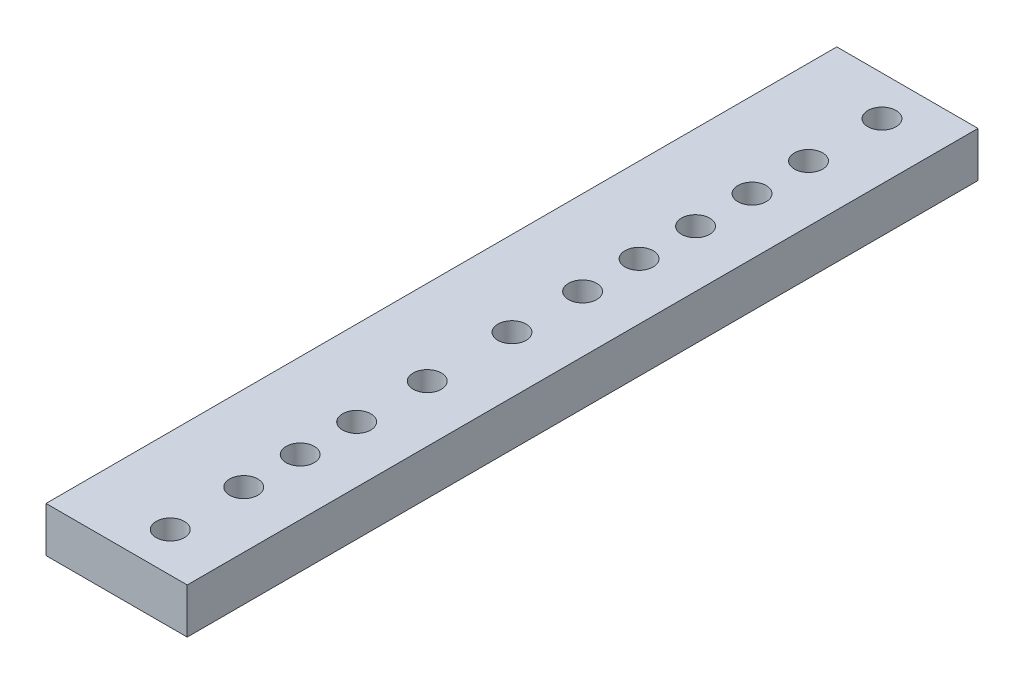
from build123d import *

# Parameters (mm, degrees)
SKETCH1_W           = 25
SKETCH1_H           = 140
BOSS_EXTRUDE1_DEPTH = 8
SKETCH2_R           = 2.5
CUT_EXTRUDE1_DEPTH  = 143.439460825
SKETCH3_R           = 2.5
CUT_EXTRUDE2_DEPTH  = 143.439460825


with BuildPart() as part:
    # Sketch1 → Boss-Extrude1 (new body)
    with BuildSketch(Plane(origin=(0, 0, 0), x_dir=(1, 0, 0), z_dir=(0, 1, 0))):
        with Locations((12.5, 70)):
            Rectangle(SKETCH1_W, SKETCH1_H)
    extrude(amount=BOSS_EXTRUDE1_DEPTH)

    # Sketch2 → Cut-Extrude1 (cut, through all)
    with BuildSketch(Plane(origin=(0, 8, 0), x_dir=(1, 0, 0), z_dir=(0, 1, 0))):
        with Locations(Location((15, 7, 0), (0, 0, 270))):
            Circle(SKETCH2_R)
        with Locations(Location((15, 20, 0), (0, 0, 270))):
            Circle(SKETCH2_R)
        with Locations(Location((15, 30, 0), (0, 0, 270))):
            Circle(SKETCH2_R)
        with Locations(Location((15, 40, 0), (0, 0, 270))):
            Circle(SKETCH2_R)
        with Locations(Location((15, 52.5, 0), (0, 0, 270))):
            Circle(SKETCH2_R)
    extrude(amount=-CUT_EXTRUDE1_DEPTH, mode=Mode.SUBTRACT)

    # Sketch3 → Cut-Extrude2 (cut, through all)
    with BuildSketch(Plane(origin=(0, 0, 0), x_dir=(-1, 0, 0), z_dir=(0, -1, 0))):
        with Locations(Location((-14.998416969, 67.499999916, 0), (0, 0, 90))):
            Circle(SKETCH3_R)
        with Locations(Location((-14.997923514, 79.999999907, 0), (0, 0, 90))):
            Circle(SKETCH3_R)
        with Locations(Location((-14.997645062, 89.999999903, 0), (0, 0, 90))):
            Circle(SKETCH3_R)
        with Locations(Location((-14.997495222, 99.999999902, 0), (0, 0, 90))):
            Circle(SKETCH3_R)
        with Locations(Location((-14.99739352, 109.999999901, 0), (0, 0, 90))):
            Circle(SKETCH3_R)
        with Locations(Location((-14.997327839, 119.999999901, 0), (0, 0, 90))):
            Circle(SKETCH3_R)
        with Locations(Location((-14.997270403, 132.999999901, 0), (0, 0, 90))):
            Circle(SKETCH3_R)
    extrude(amount=-CUT_EXTRUDE2_DEPTH, mode=Mode.SUBTRACT)


solid = part.part
